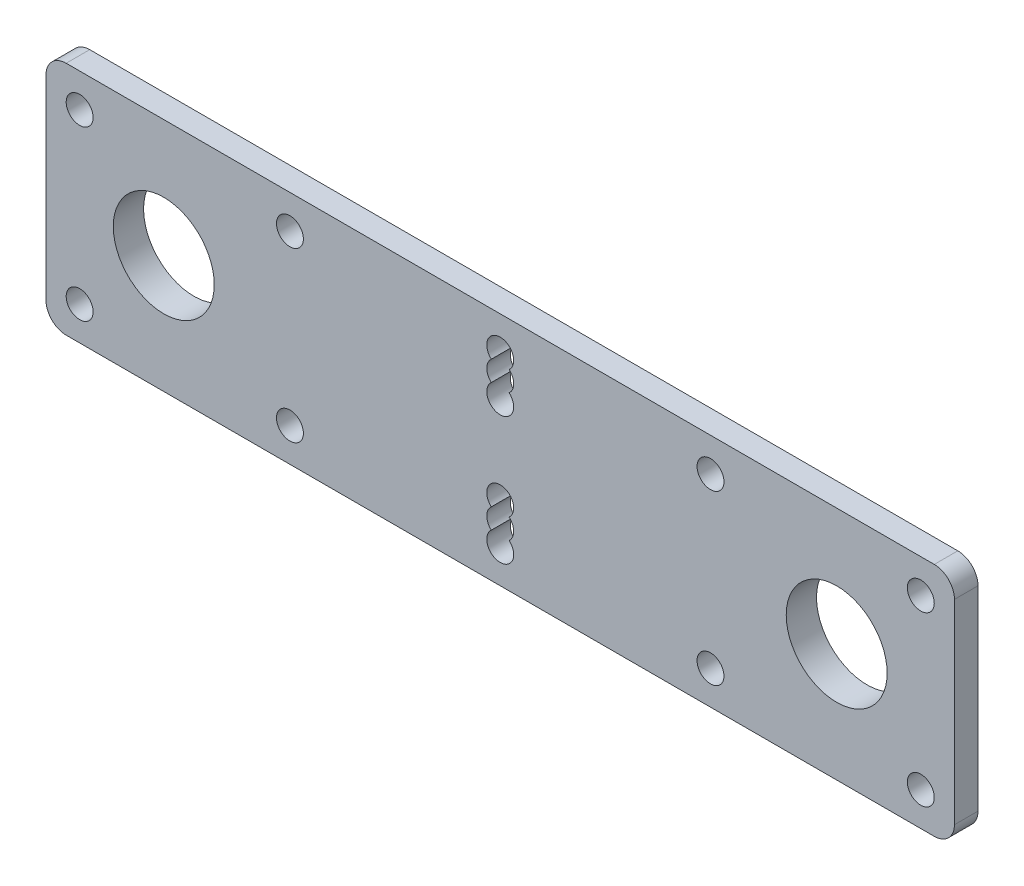
from build123d import *

# Parameters (mm, degrees)
SKETCH1_W           = 270
SKETCH1_H           = 70
BOSS_EXTRUDE1_DEPTH = 7
FILLET1_R           = 6
SKETCH2_R           = 15
SKETCH2_R_2         = 4
CUT_EXTRUDE1_DEPTH  = 10
BOSS_EXTRUDE2_START = 2
SKETCH3_R           = 20
SKETCH3_R_2         = 15
BOSS_EXTRUDE2_DEPTH = 2


with BuildPart() as part:
    # Sketch1 → Boss-Extrude1 (new body)
    with BuildSketch(Plane.XY):
        Rectangle(SKETCH1_W, SKETCH1_H)
    extrude(amount=BOSS_EXTRUDE1_DEPTH)

    # Fillet1
    fillet1_edges = [part.edges().sort_by_distance(p)[0] for p in [
        (135, -35, 3.5),
        (-135, -35, 3.5),
        (-135, 35, 3.5),
        (135, 35, 3.5),
    ]]
    fillet(fillet1_edges, radius=FILLET1_R)

    # Sketch2 → Cut-Extrude1 (cut)
    with BuildSketch(Plane(origin=(0, 0, 0), x_dir=(-1, 0, 0), z_dir=(0, 0, -1))):
        with Locations((-100, 0)):
            Circle(SKETCH2_R)
        with Locations((100, 0)):
            Circle(SKETCH2_R)
        with Locations((125, 25)):
            Circle(SKETCH2_R_2)
        with Locations((62.5, 25)):
            Circle(SKETCH2_R_2)
        with Locations((-62.5, 25)):
            Circle(SKETCH2_R_2)
        with Locations((-125, 25)):
            Circle(SKETCH2_R_2)
        with Locations(Location((-125, -25, 0), (0, 0, 180))):
            Circle(SKETCH2_R_2)
        with Locations(Location((-62.5, -25, 0), (0, 0, 180))):
            Circle(SKETCH2_R_2)
        with Locations(Location((62.5, -25, 0), (0, 0, 180))):
            Circle(SKETCH2_R_2)
        with Locations(Location((125, -25, 0), (0, 0, 180))):
            Circle(SKETCH2_R_2)
        with BuildLine():
            ThreePointArc((2.645751311, 22), (0, 29), (-2.645751311, 22))
            ThreePointArc((-2.645751311, 22), (-4, 19), (-2.645751311, 16))
            ThreePointArc((-2.645751311, 16), (0, 9), (2.645751311, 16))
            ThreePointArc((2.645751311, 16), (4, 19), (2.645751311, 22))
        make_face()
        with BuildLine():
            ThreePointArc((2.645751311, -22), (0, -29), (-2.645751311, -22))
            ThreePointArc((-2.645751311, -22), (-4, -19), (-2.645751311, -16))
            ThreePointArc((-2.645751311, -16), (0, -9), (2.645751311, -16))
            ThreePointArc((2.645751311, -16), (4, -19), (2.645751311, -22))
        make_face()
    extrude(amount=-CUT_EXTRUDE1_DEPTH, mode=Mode.SUBTRACT)

    # Sketch3 → Boss-Extrude2 (add)
    # profile 1 of 2: a face of its own
    with BuildSketch(Plane(origin=(0, 0, 0), x_dir=(-1, 0, 0), z_dir=(0, 0, -1)).offset(BOSS_EXTRUDE2_START)):
        with Locations(Location((-100, 0, 0), (0, 0, 180))):
            Circle(SKETCH3_R)
        with Locations((-100, 0)):
            Circle(SKETCH3_R_2, mode=Mode.SUBTRACT)
    # profile 2 of 2: a face of its own
    with BuildSketch(Plane(origin=(0, 0, 0), x_dir=(-1, 0, 0), z_dir=(0, 0, -1)).offset(BOSS_EXTRUDE2_START)):
        with Locations(Location((100, 0, 0), (0, 0, 180))):
            Circle(SKETCH3_R)
        with Locations((100, 0)):
            Circle(SKETCH3_R_2, mode=Mode.SUBTRACT)
    extrude(amount=-BOSS_EXTRUDE2_DEPTH)


solid = part.part
